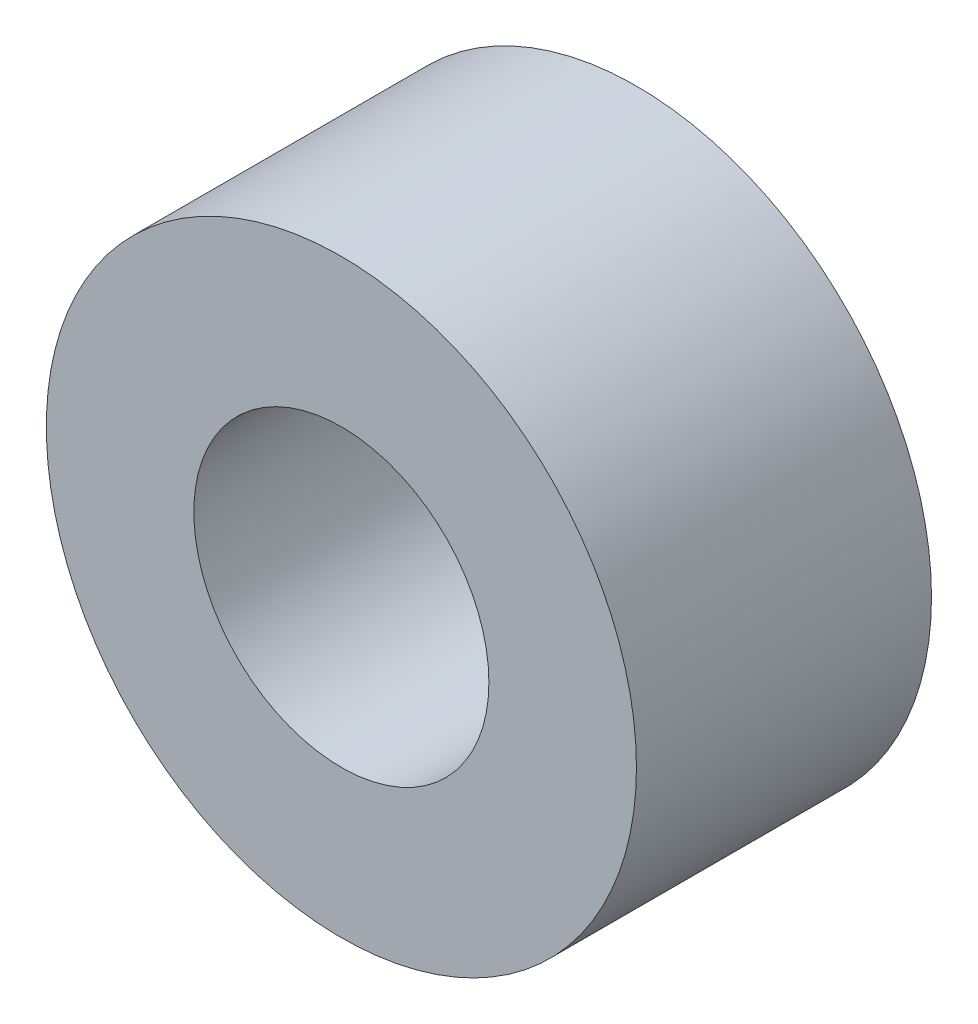
from build123d import *

# Parameters (mm, degrees)
SKETCH1_R           = 25.4
SKETCH1_R_2         = 12.7
BOSS_EXTRUDE1_DEPTH = 25.4


with BuildPart() as part:
    # Sketch1 → Boss-Extrude1 (new body)
    with BuildSketch(Plane.XY):
        Circle(SKETCH1_R)
        Circle(SKETCH1_R_2, mode=Mode.SUBTRACT)
    extrude(amount=BOSS_EXTRUDE1_DEPTH)


solid = part.part
